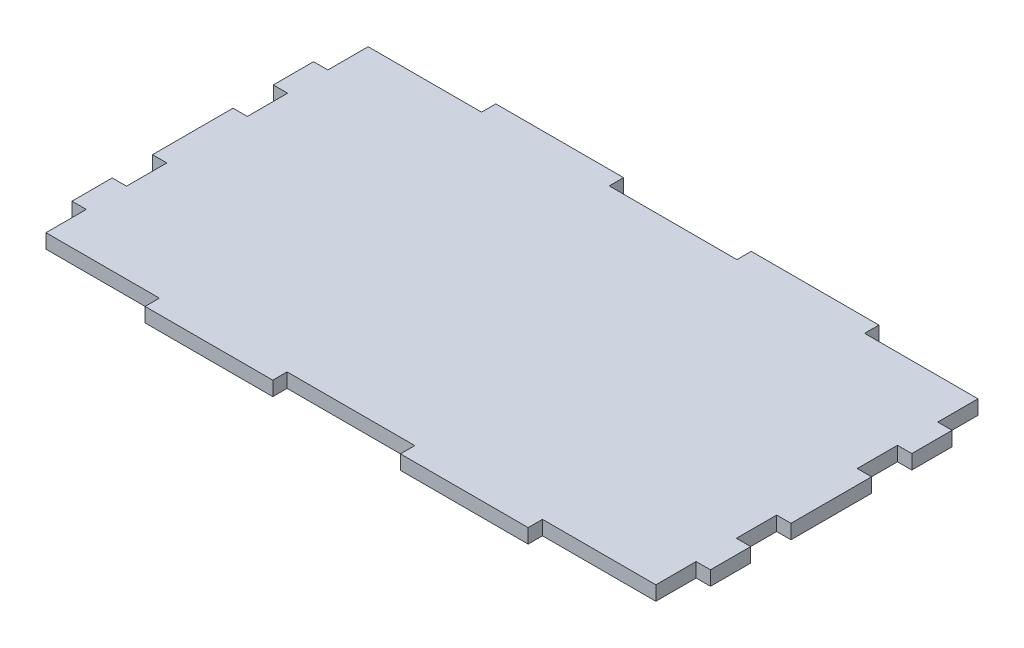
from build123d import *

# Parameters (mm, degrees)
SKETCH1_W           = 509.74752
SKETCH1_H           = 280.0477
BOSS_EXTRUDE1_DEPTH = 11.43
SKETCH2_W           = 11.43
SKETCH2_H           = 32.1484625
SKETCH2_W_2         = 50.974752
SKETCH2_H_2         = 11.43
SKETCH2_W_3         = 101.949504
CUT_EXTRUDE1_DEPTH  = 431.412807943


with BuildPart() as part:
    # Sketch1 → Boss-Extrude1 (new body)
    with BuildSketch(Plane(origin=(0, 0, 0), x_dir=(1, 0, 0), z_dir=(0, 1, 0))):
        with Locations((-100.108024585, -103.106717707)):
            Rectangle(SKETCH1_W, SKETCH1_H)
    extrude(amount=BOSS_EXTRUDE1_DEPTH)

    # Sketch2 → Cut-Extrude1 (cut, through all)
    with BuildSketch(Plane(origin=(0, 11.43, 0), x_dir=(1, 0, 0), z_dir=(0, 1, 0))):
        with Locations((-349.266784585, -151.329411457)):
            Rectangle(SKETCH2_W, SKETCH2_H)
        with Locations((-349.266784585, -215.626336457)):
            Rectangle(SKETCH2_W, SKETCH2_H)
        Polygon((-354.981784585, -243.130567707), (-253.032280585, -243.130567707), (-253.032280585, -231.700567707), (-343.551784585, -231.700567707), (-354.981784585, -231.700567707), align=None)
        with Locations((-74.620648585, -237.415567707)):
            Rectangle(SKETCH2_W_2, SKETCH2_H_2)
        with Locations((-125.595400585, -237.415567707)):
            Rectangle(SKETCH2_W_2, SKETCH2_H_2)
        with Locations((103.790983415, -237.415567707)):
            Rectangle(SKETCH2_W_3, SKETCH2_H_2)
        with Locations((149.050735415, -215.626336457)):
            Rectangle(SKETCH2_W, SKETCH2_H)
        with Locations((149.050735415, -151.329411457)):
            Rectangle(SKETCH2_W, SKETCH2_H)
        with Locations((149.050735415, -54.884023957)):
            Rectangle(SKETCH2_W, SKETCH2_H)
        with Locations((149.050735415, 9.412901043)):
            Rectangle(SKETCH2_W, SKETCH2_H)
        with Locations((103.790983415, 31.202132293)):
            Rectangle(SKETCH2_W_3, SKETCH2_H_2)
        with Locations((-100.108024585, 31.202132293)):
            Rectangle(SKETCH2_W_3, SKETCH2_H_2)
        with Locations((-349.266784585, -54.884023957)):
            Rectangle(SKETCH2_W, SKETCH2_H)
        with Locations((-349.266784585, 9.412901043)):
            Rectangle(SKETCH2_W, SKETCH2_H)
        with Locations((-304.007032585, 31.202132293)):
            Rectangle(SKETCH2_W_3, SKETCH2_H_2)
    extrude(amount=-CUT_EXTRUDE1_DEPTH, mode=Mode.SUBTRACT)


solid = part.part
